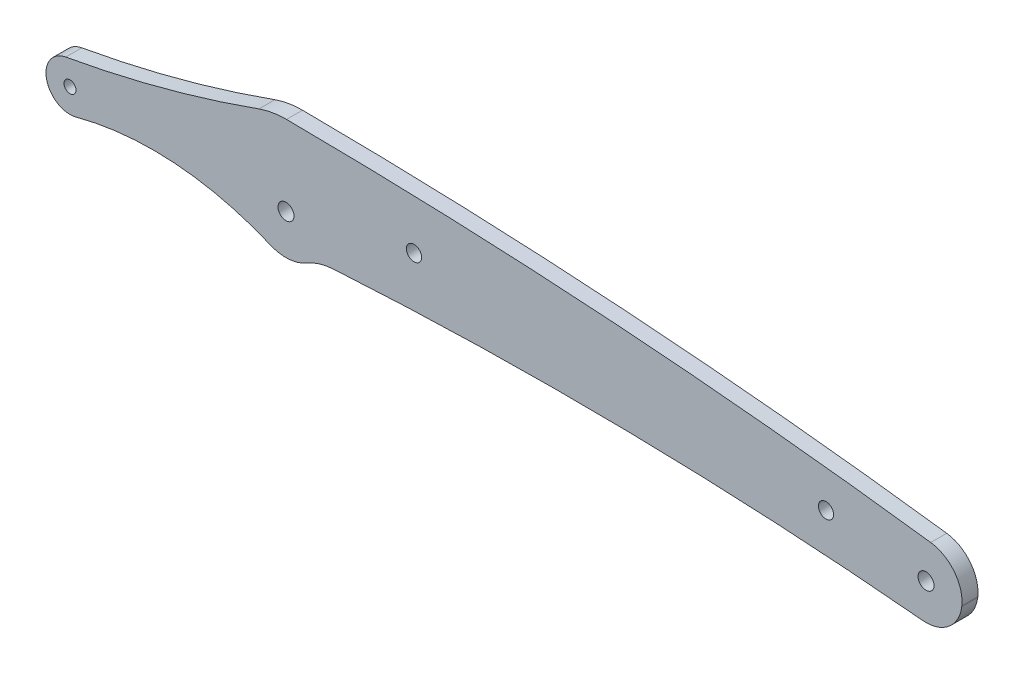
from build123d import *

# Parameters (mm, degrees)
SKETCH_1_R          = 1.9
SKETCH_1_R_2        = 1.5
SKETCH_1_R_3        = 2
EXTRUDE_1_DEPTH     = 4
SKETCH_2_R          = 2
CUT_EXTRUDE_1_DEPTH = 171.226319939


with BuildPart() as part:
    # 草图1 → 凸台-拉伸1 (new body)
    with BuildSketch(Plane.XY):
        with BuildLine():
            Line((168.953879648, -0.909966618), (168.931448962, -1.108701692))
            ThreePointArc((168.931448962, -1.108701692), (165.63568786, -7.017052255), (159.155370177, -8.960279039))
            ThreePointArc((159.155370177, -8.960279039), (85.523468127, -4.894349995), (11.798026408, -6.552065898))
            ThreePointArc((11.798026408, -6.552065898), (8.320365096, -7.182704729), (5.086801975, -8.609555486))
            ThreePointArc((5.086801975, -8.609555486), (0.664725554, -9.977882538), (-3.899782135, -9.208240836))
            ThreePointArc((-3.899782135, -9.208240836), (-27.893230932, -3.454367969), (-52.455418381, -5.797781267))
            ThreePointArc((-52.455418381, -5.797781267), (-59.85652595, -1.304263697), (-55.061728395, 5.905313947))
            ThreePointArc((-55.061728395, 5.905313947), (-30.640902591, 11.356196493), (-6.759259259, 18.823188207))
            ThreePointArc((-6.759259259, 18.823188207), (-3.365966263, 19.714722192), (0.130908203, 19.999571571))
            ThreePointArc((0.130908203, 19.999571571), (80.824453525, 16.963385457), (161.173821166, 8.923124109))
            ThreePointArc((161.173821166, 8.923124109), (167.057974161, 5.584353207), (168.953879648, -0.909966618))
        make_face()
        with Locations((32, 7)):
            Circle(SKETCH_1_R, mode=Mode.SUBTRACT)
        with Locations((135, 2.8)):
            Circle(SKETCH_1_R, mode=Mode.SUBTRACT)
        with Locations((-54, 0)):
            Circle(SKETCH_1_R_2, mode=Mode.SUBTRACT)
        Circle(SKETCH_1_R_3, mode=Mode.SUBTRACT)
        with Locations((160, 0)):
            Circle(SKETCH_1_R_2, mode=Mode.SUBTRACT)
    extrude(amount=EXTRUDE_1_DEPTH)

    # 草图2 → 切除-拉伸1 (cut, through all)
    with BuildSketch(Plane.XY.offset(4)):
        with Locations((160, 0)):
            Circle(SKETCH_2_R)
    extrude(amount=-CUT_EXTRUDE_1_DEPTH, mode=Mode.SUBTRACT)


solid = part.part
